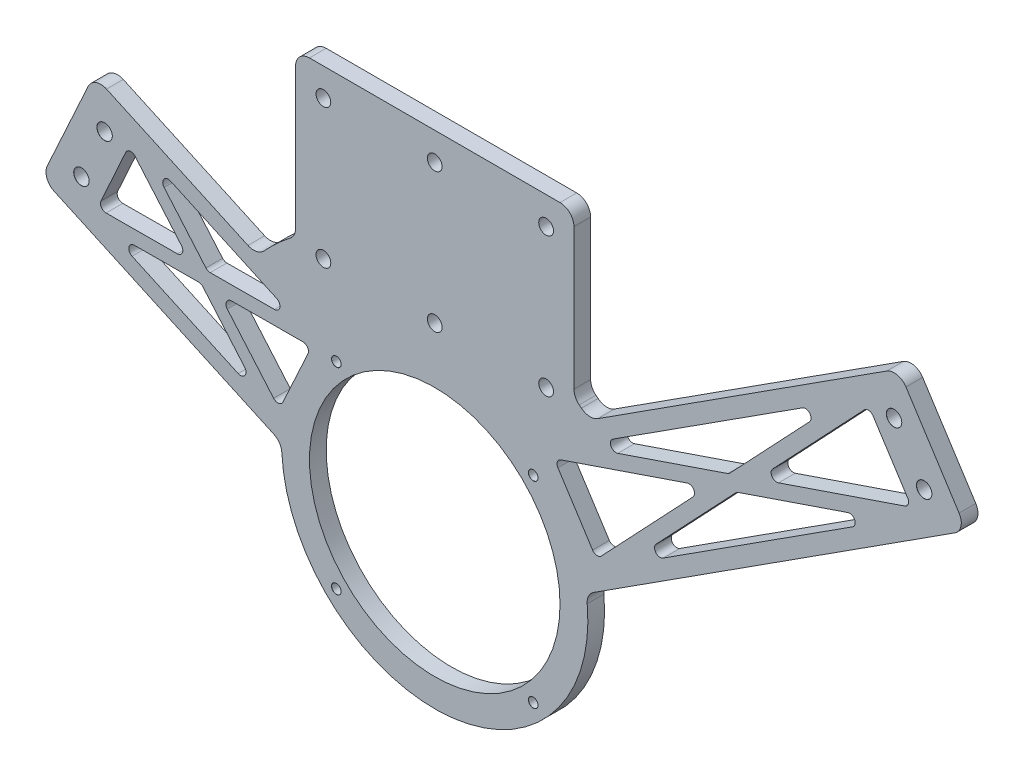
from build123d import *

# Parameters (mm, degrees)
SKETCH8_R                      = 2.65
SKETCH8_R_2                    = 45
BOSS_EXTRUDE12_DEPTH           = 6
M5_CLEARANCE_HOLE3_D           = 5.5
M5_CLEARANCE_HOLE3_CSINK_D     = 5.55
M5_CLEARANCE_HOLE3_CSINK_ANGLE = 90
M3_CLEARANCE_HOLE2_D           = 3.4
M3_CLEARANCE_HOLE2_CSINK_D     = 3.45
M3_CLEARANCE_HOLE2_CSINK_ANGLE = 90
CUT_EXTRUDE12_DEPTH            = 234.420888215
FILLET16_R                     = 2
FILLET17_R                     = 2
FILLET13_R                     = 5


with BuildPart() as part:
    # Sketch8 → Boss-Extrude12 (new body)
    with BuildSketch(Plane.XY):
        with BuildLine():
            ThreePointArc((50, 66.988603427), (52.767551736, 64.83099932), (55.442106877, 62.559138214))
            Line((55.442106877, 62.559138214), (166.556546856, 133.975526494))
            Line((166.556546856, 133.975526494), (191.049389833, 95.86790727))
            Line((191.049389833, 95.86790727), (54.408449025, 8.044916078))
            ThreePointArc((54.408449025, 8.044916078), (3.903634668, -54.86129452), (-54.999385248, 0.260042998))
            Line((-54.999385248, 0.260042998), (-141.274934171, 39.741860486))
            Line((-141.274934171, 39.741860486), (-122.4246033, 80.933546856))
            Line((-122.4246033, 80.933546856), (-63.741426655, 54.07867895))
            ThreePointArc((-63.741426655, 54.07867895), (-57.235867879, 60.922314608), (-50, 66.988603427))
            Line((-50, 66.988603427), (-50, 125))
            Line((-50, 125), (50, 125))
            Line((50, 125), (50, 66.988603427))
        make_face()
        with Locations((-40, 65)):
            Circle(SKETCH8_R, mode=Mode.SUBTRACT)
        with Locations((0, 65)):
            Circle(SKETCH8_R, mode=Mode.SUBTRACT)
        with Locations((40, 65)):
            Circle(SKETCH8_R, mode=Mode.SUBTRACT)
        with Locations((0, 115)):
            Circle(SKETCH8_R, mode=Mode.SUBTRACT)
        with Locations((40, 115)):
            Circle(SKETCH8_R, mode=Mode.SUBTRACT)
        with Locations((-40, 115)):
            Circle(SKETCH8_R, mode=Mode.SUBTRACT)
        Circle(SKETCH8_R_2, mode=Mode.SUBTRACT)
    extrude(amount=BOSS_EXTRUDE12_DEPTH)

    # M5 Clearance Hole3 (through all)
    with Locations(Plane.XY.offset(6)):
        with Locations((-118.595460294, 65.269570227), (-126.91790218, 47.083395229), (164.983881766, 117.927186252), (175.797498975, 101.102630303)):
            CounterSinkHole(M5_CLEARANCE_HOLE3_D / 2, M5_CLEARANCE_HOLE3_CSINK_D / 2, counter_sink_angle=M5_CLEARANCE_HOLE3_CSINK_ANGLE)

    # M3 Clearance Hole2 (through all)
    with Locations(Plane.XY.offset(6)):
        with Locations((-35.355339059, 35.355339059), (35.355339059, 35.355339059), (35.355339059, -35.355339059), (-35.355339059, -35.355339059)):
            CounterSinkHole(M3_CLEARANCE_HOLE2_D / 2, M3_CLEARANCE_HOLE2_CSINK_D / 2, counter_sink_angle=M3_CLEARANCE_HOLE2_CSINK_ANGLE)

    # Sketch45 → Cut-Extrude12 (cut, through all)
    with BuildSketch(Plane.XY.offset(6)):
        Polygon((-116.995223223, 35.229285226), (-62.355834999, 10.224954562), (-83.893277645, 35.362478421), align=None)
        Polygon((-81.600914837, 40.371742739), (-103.138357483, 65.509266598), (-48.498969259, 40.504935934), align=None)
        Polygon((-55.848576336, 10.314784068), (-44.229729779, 35.522073712), (-77.331675357, 35.388880518), align=None)
        Polygon((-109.699959772, 65.482864501), (-88.162517126, 40.345340642), (-121.180939336, 40.212483522), align=None)
        Polygon((42.86381576, 44.280773431), (58.083519932, 20.600929819), (98.313351899, 63.188767486), align=None)
        Polygon((171.270720077, 93.349539589), (115.821183938, 74.441545533), (156.051015905, 117.0293832), align=None)
        Polygon((68.229920192, 24.060797821), (163.909288297, 85.556629544), (108.459752158, 66.648635488), align=None)
        Polygon((145.904615645, 113.569515198), (105.674783679, 70.981677531), (50.22524754, 52.073683476), align=None)
    extrude(amount=-CUT_EXTRUDE12_DEPTH, mode=Mode.SUBTRACT)

    # Fillet16
    fillet16_edges = [part.edges().sort_by_distance(p)[0] for p in [
        (-77.331675357, 35.388880518, 3),
        (-44.229729779, 35.522073712, 3),
        (-55.848576336, 10.314784068, 3),
        (-48.498969259, 40.504935934, 3),
        (-81.600914837, 40.371742739, 3),
        (-103.138357483, 65.509266598, 3),
        (-121.180939336, 40.212483522, 3),
        (-109.699959772, 65.482864501, 3),
        (-88.162517126, 40.345340642, 3),
        (-83.893277645, 35.362478421, 3),
        (-62.355834999, 10.224954562, 3),
        (-116.995223223, 35.229285226, 3),
    ]]
    fillet(fillet16_edges, radius=FILLET16_R)

    # Fillet17
    fillet17_edges = [part.edges().sort_by_distance(p)[0] for p in [
        (156.051015905, 117.0293832, 3),
        (171.270720077, 93.349539589, 3),
        (115.821183938, 74.441545533, 3),
        (108.459752158, 66.648635488, 3),
        (163.909288297, 85.556629544, 3),
        (68.229920192, 24.060797821, 3),
        (98.313351899, 63.188767486, 3),
        (58.083519932, 20.600929819, 3),
        (42.86381576, 44.280773431, 3),
        (50.22524754, 52.073683476, 3),
        (145.904615645, 113.569515198, 3),
        (105.674783679, 70.981677531, 3),
    ]]
    fillet(fillet17_edges, radius=FILLET17_R)

    # Fillet13
    fillet13_edges = [part.edges().sort_by_distance(p)[0] for p in [
        (55.442106877, 62.559138214, 3),
        (166.556546856, 133.975526494, 3),
        (191.049389833, 95.86790727, 3),
        (54.408449025, 8.044916078, 3),
        (-54.999385248, 0.260042998, 3),
        (-141.274934171, 39.741860486, 3),
        (-122.4246033, 80.933546856, 3),
        (-63.741426655, 54.07867895, 3),
        (-50, 66.988603427, 3),
        (-50, 125, 3),
        (50, 125, 3),
        (50, 66.988603427, 3),
    ]]
    fillet(fillet13_edges, radius=FILLET13_R)


solid = part.part
